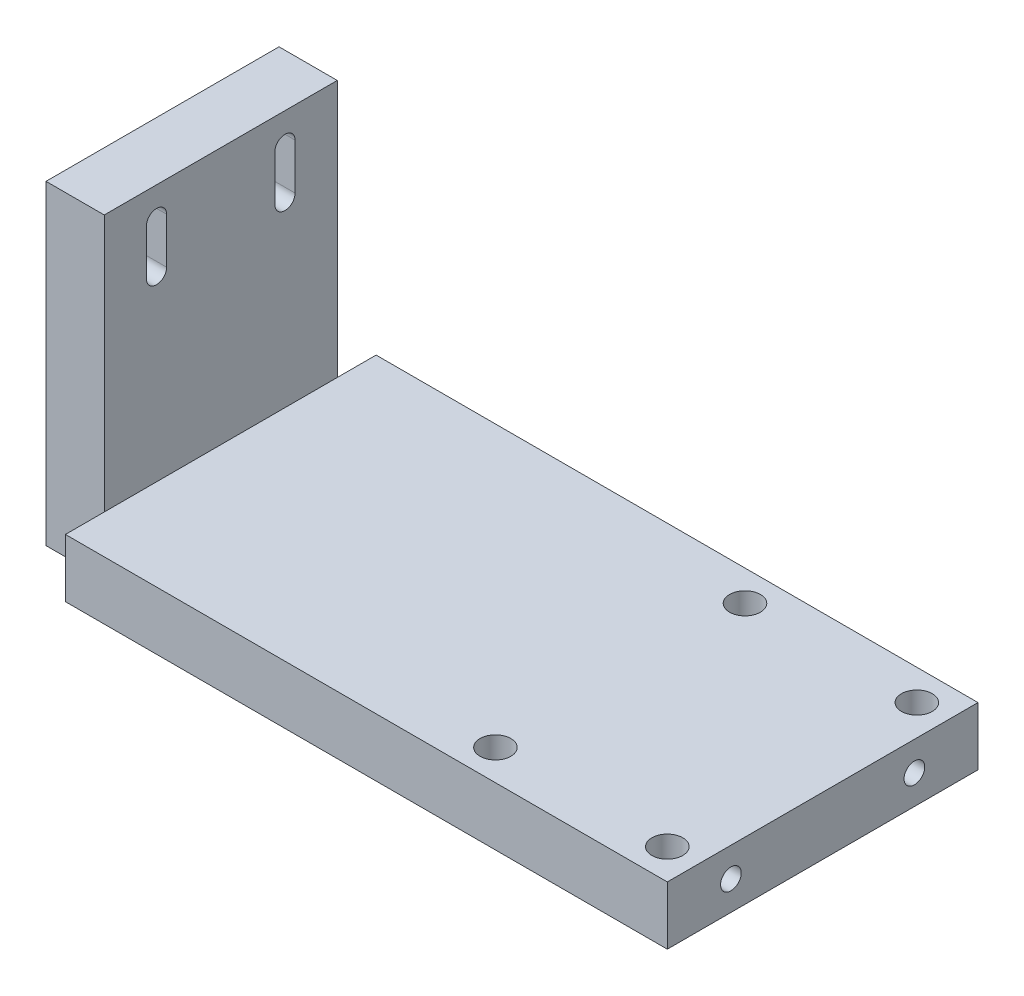
from build123d import *

# Parameters (mm, degrees)
CROQUIS18_ON_SEGMENT_1_W                      = 101.6
CROQUIS18_ON_SEGMENT_1_H                      = 19.05
SOLID_3_X_0_75_1_DEPTH                        = 103.175
SOLID_3_X_0_75_1_2_DEPTH                      = 206.35
SOLID_3_X_0_75_1_2_DEPTH_BACK                 = 1
CROQUIS18_W                                   = 101.6
CROQUIS18_H                                   = 19.05
CORTAR_EXTRUIR1_DEPTH                         = 224.810283778
CROQUIS14_W                                   = 5.0419
CROQUIS14_H                                   = 19.05
TALADRO_DE_MARGEN_PARA_3_81_AT_2_COUNT        = 2
TALADRO_DE_MARGEN_PARA_3_81_AT_2_PITCH        = 56.2
TALADRO_DE_MARGEN_PARA_3_81_AT_3_COUNT        = 2
TALADRO_DE_MARGEN_PARA_3_81_AT_3_PITCH        = 81.6
TALADRO_DE_MARGEN_PARA_3_81_AT_4_COUNT        = 2
TALADRO_DE_MARGEN_PARA_3_81_AT_4_PITCH        = 99.080775128
SKETCH3_W                                     = 19.05
SKETCH3_H                                     = 12.7
CUT_EXTRUDE2_DEPTH                            = 237.233027168
CBORE_FOR_1_4_SOCKET_HEAD_CAP_SCREW1_AT_COUNT = 2
CBORE_FOR_1_4_SOCKET_HEAD_CAP_SCREW1_AT_PITCH = 60


with BuildPart() as part:
    # Croquis18 on segment 1 (carried to segment 1) → Solid 3 X 0.75(1) (new body)
    with BuildSketch(Plane(origin=(0, 93.65, 0), x_dir=(0, 0, 1), z_dir=(0, -1, 0))):
        Rectangle(CROQUIS18_ON_SEGMENT_1_W, CROQUIS18_ON_SEGMENT_1_H)
    extrude(amount=SOLID_3_X_0_75_1_DEPTH)

    # Croquis12 → Cortar-Extruir1 (cut, through all)
    with BuildSketch(Plane(origin=(9.525, 0, 0), x_dir=(0, 0, -1), z_dir=(1, 0, 0))):
        with BuildLine():
            Line((-17.7, 83.65), (-17.7, 68.65))
            ThreePointArc((-17.7, 68.65), (-21, 65.35), (-24.3, 68.65))
            Line((-24.3, 68.65), (-24.3, 83.65))
            ThreePointArc((-24.3, 83.65), (-21, 86.95), (-17.7, 83.65))
        make_face()
        with BuildLine():
            Line((17.7, 83.65), (17.7, 68.65))
            ThreePointArc((17.7, 68.65), (21, 65.35), (24.3, 68.65))
            Line((24.3, 68.65), (24.3, 83.65))
            ThreePointArc((24.3, 83.65), (21, 86.95), (17.7, 83.65))
        make_face()
    extrude(amount=-CORTAR_EXTRUIR1_DEPTH, mode=Mode.SUBTRACT)

    # Sketch3 → Cut-Extrude2 (cut, through all)
    with BuildSketch(Plane(origin=(0, 93.65, 0), x_dir=(1, 0, 0), z_dir=(0, 1, 0))):
        with Locations((0, -44.45)):
            Rectangle(SKETCH3_W, SKETCH3_H)
        with Locations((0, 44.45)):
            Rectangle(SKETCH3_W, SKETCH3_H)
    extrude(amount=-CUT_EXTRUDE2_DEPTH, mode=Mode.SUBTRACT)


with BuildPart() as body_2:
    # Croquis18 → Solid 3 X 0.75_1 2 (new, two sides: drawn at the far end of the back side and taken through both)
    with BuildSketch(Plane(origin=(0, 0, 0), x_dir=(0, 0, 1), z_dir=(1, 0, 0)).offset(-SOLID_3_X_0_75_1_2_DEPTH_BACK)):
        Rectangle(CROQUIS18_W, CROQUIS18_H)
    extrude(amount=SOLID_3_X_0_75_1_2_DEPTH + SOLID_3_X_0_75_1_2_DEPTH_BACK)

    # Solid 3 X 0.75_1 2 end butt 1
    split(bisect_by=Plane.YZ.offset(9.525), keep=Keep.TOP)

    # Croquis14 → Taladro de margen para 3/81 (revolve, cut)
    with BuildSketch(Plane(origin=(196.35, 9.525, 40.8), x_dir=(0, 0, 1), z_dir=(1, 0, 0))):
        with Locations((2.52095, 9.525)):
            Rectangle(CROQUIS14_W, CROQUIS14_H)
    taladro_de_margen_para_3_81 = revolve(axis=Axis((196.35, 15.875, 40.8), (0, -1, 0)), mode=Mode.SUBTRACT)

    # Taladro de margen para 3/81 at 2: Taladro de margen para 3/81 ×2
    with Locations(*[(-i * TALADRO_DE_MARGEN_PARA_3_81_AT_2_PITCH, 0, 0) for i in range(1, TALADRO_DE_MARGEN_PARA_3_81_AT_2_COUNT)]):
        add(taladro_de_margen_para_3_81, mode=Mode.SUBTRACT)

    # Taladro de margen para 3/81 at 3: Taladro de margen para 3/81 ×2
    with Locations(*[(0, 0, -i * TALADRO_DE_MARGEN_PARA_3_81_AT_3_PITCH) for i in range(1, TALADRO_DE_MARGEN_PARA_3_81_AT_3_COUNT)]):
        add(taladro_de_margen_para_3_81, mode=Mode.SUBTRACT)

    # Taladro de margen para 3/81 at 4: Taladro de margen para 3/81 ×2
    with Locations(*[Vector(-0.567213971906228, 2.8685392694633734e-15, -0.823570464547121) * (i * TALADRO_DE_MARGEN_PARA_3_81_AT_4_PITCH) for i in range(1, TALADRO_DE_MARGEN_PARA_3_81_AT_4_COUNT)]):
        add(taladro_de_margen_para_3_81, mode=Mode.SUBTRACT)


with BuildPart() as cbore_for_1_4_socket_head_cap_screw1_tool:
    # Sketch6 → CBORE for 1/4 Socket Head Cap Screw1 (revolve)
    with BuildSketch(Plane(origin=(-9.525, 0, 30), x_dir=(0, 0, 1), z_dir=(0, 1, 0))):
        Polygon((0, 0), (0, 40.129827343), (3.3782, 38.1), (3.3782, 6.35), (5.55625, 6.35), (5.55625, 0), align=None)
    cbore_for_1_4_socket_head_cap_screw1 = revolve(axis=Axis((-15.875, 0, 30), (1, 0, 0)))


with BuildPart() as part_1:
    add(part.part)

    # CBORE for 1/4 Socket Head Cap Screw1: cut by cbore_for_1_4_socket_head_cap_screw1_tool
    add(cbore_for_1_4_socket_head_cap_screw1_tool.part, mode=Mode.SUBTRACT)


with BuildPart() as body_2_1:
    add(body_2.part)

    # CBORE for 1/4 Socket Head Cap Screw1: cut by cbore_for_1_4_socket_head_cap_screw1_tool
    add(cbore_for_1_4_socket_head_cap_screw1_tool.part, mode=Mode.SUBTRACT)


with BuildPart() as cbore_for_1_4_socket_head_cap_screw1_at_tool:
    # CBORE for 1/4 Socket Head Cap Screw1 at: CBORE for 1/4 Socket Head Cap Screw1 ×2
    with Locations(*[(0, 0, -i * CBORE_FOR_1_4_SOCKET_HEAD_CAP_SCREW1_AT_PITCH) for i in range(1, CBORE_FOR_1_4_SOCKET_HEAD_CAP_SCREW1_AT_COUNT)]):
        add(cbore_for_1_4_socket_head_cap_screw1)


with BuildPart() as part_2:
    add(part_1.part)

    # CBORE for 1/4 Socket Head Cap Screw1 at: cut by cbore_for_1_4_socket_head_cap_screw1_at_tool
    add(cbore_for_1_4_socket_head_cap_screw1_at_tool.part, mode=Mode.SUBTRACT)


with BuildPart() as body_2_2:
    add(body_2_1.part)

    # CBORE for 1/4 Socket Head Cap Screw1 at: cut by cbore_for_1_4_socket_head_cap_screw1_at_tool
    add(cbore_for_1_4_socket_head_cap_screw1_at_tool.part, mode=Mode.SUBTRACT)

    # Mirror1: CBORE for 1/4 Socket Head Cap Screw1 across plane
    add(cbore_for_1_4_socket_head_cap_screw1.mirror(Plane.ZY.offset(-107.9375)), mode=Mode.SUBTRACT)

    # Mirror1 copy 1 sketch → Mirror1 copy 1 (revolve, cut)
    with BuildSketch(Plane(origin=(225.4, 0, -30), x_dir=(0, 0, 1), z_dir=(0, 1, 0))):
        Polygon((0, 0), (0, -40.129827343), (3.3782, -38.1), (3.3782, -6.35), (5.55625, -6.35), (5.55625, 0), align=None)
    revolve(axis=Axis((231.75, 0, -30), (1, 0, 0)), mode=Mode.SUBTRACT)


solid = Compound([part_2.part, body_2_2.part])
